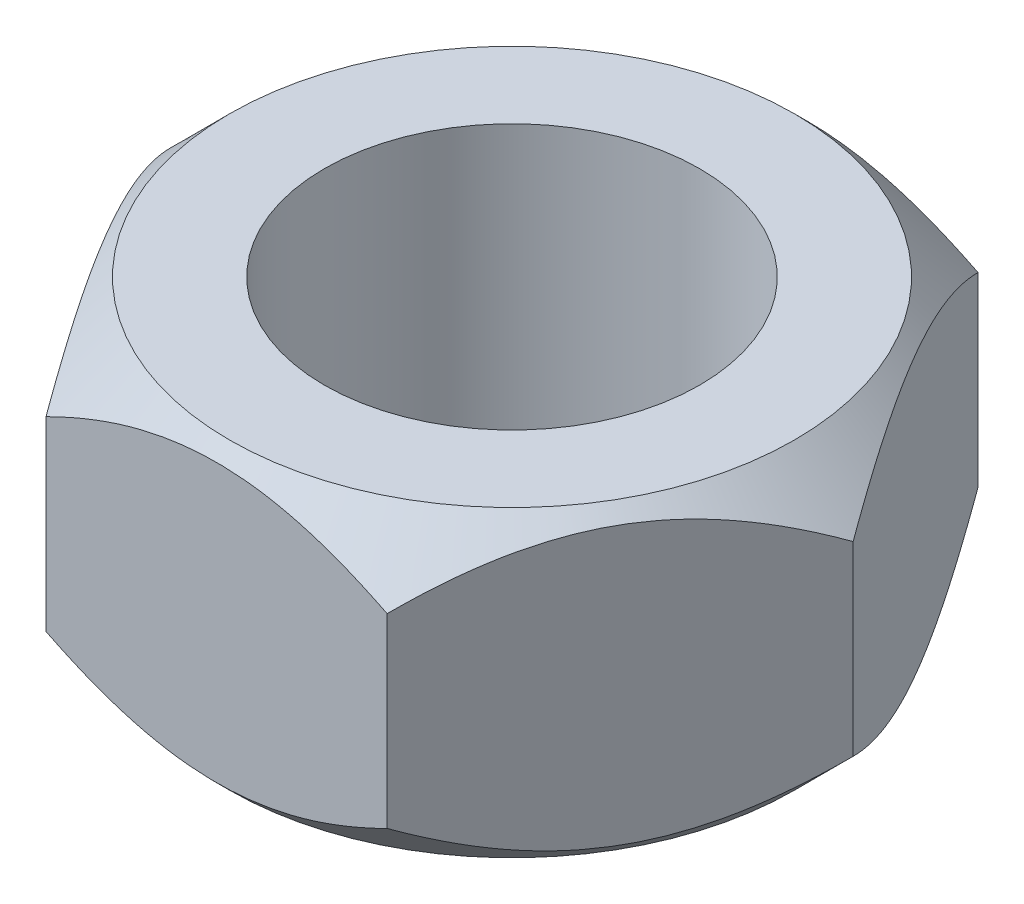
from build123d import *

# Parameters (mm, degrees)
SKETCH1_R           = 6
BOSS_EXTRUDE1_DEPTH = 9.7


with BuildPart() as part:
    # Sketch1 → Boss-Extrude1 (new body)
    with BuildSketch(Plane(origin=(0, 0, 0), x_dir=(1, 0, 0), z_dir=(0, 1, 0))):
        Polygon((-10.910534447, 0), (-5.455267224, -9.4488), (5.455267224, -9.4488), (10.910534447, 0), (5.455267224, 9.4488), (-5.455267224, 9.4488), align=None)
        with Locations(Location((0, 0, 0), (0, 0, 270))):
            Circle(SKETCH1_R, mode=Mode.SUBTRACT)
    extrude(amount=BOSS_EXTRUDE1_DEPTH)

    # Sketch3 → Cut-Revolve3 (revolve, cut)
    with BuildSketch(Plane.XY, mode=Mode.PRIVATE) as cut_revolve3_sk:
        Polygon((-9.035534447, 9.7), (-10.910534447, 9.7), (-10.910534447, 7.825), align=None)
    revolve(cut_revolve3_sk.sketch.rotate(Axis((0, 0, 0), (0, 1, 0)), 270), axis=Axis((0, 0, 0), (0, 1, 0)), mode=Mode.SUBTRACT)

    # Sketch4 → Cut-Revolve4 (revolve, cut)
    with BuildSketch(Plane.XY, mode=Mode.PRIVATE) as cut_revolve4_sk:
        Polygon((-9.035534447, 0), (-10.910534447, 0), (-10.910534447, 1.875), align=None)
    revolve(cut_revolve4_sk.sketch.rotate(Axis((0, 0, 0), (0, 1, 0)), 270), axis=Axis((0, 0, 0), (0, 1, 0)), mode=Mode.SUBTRACT)


solid = part.part
